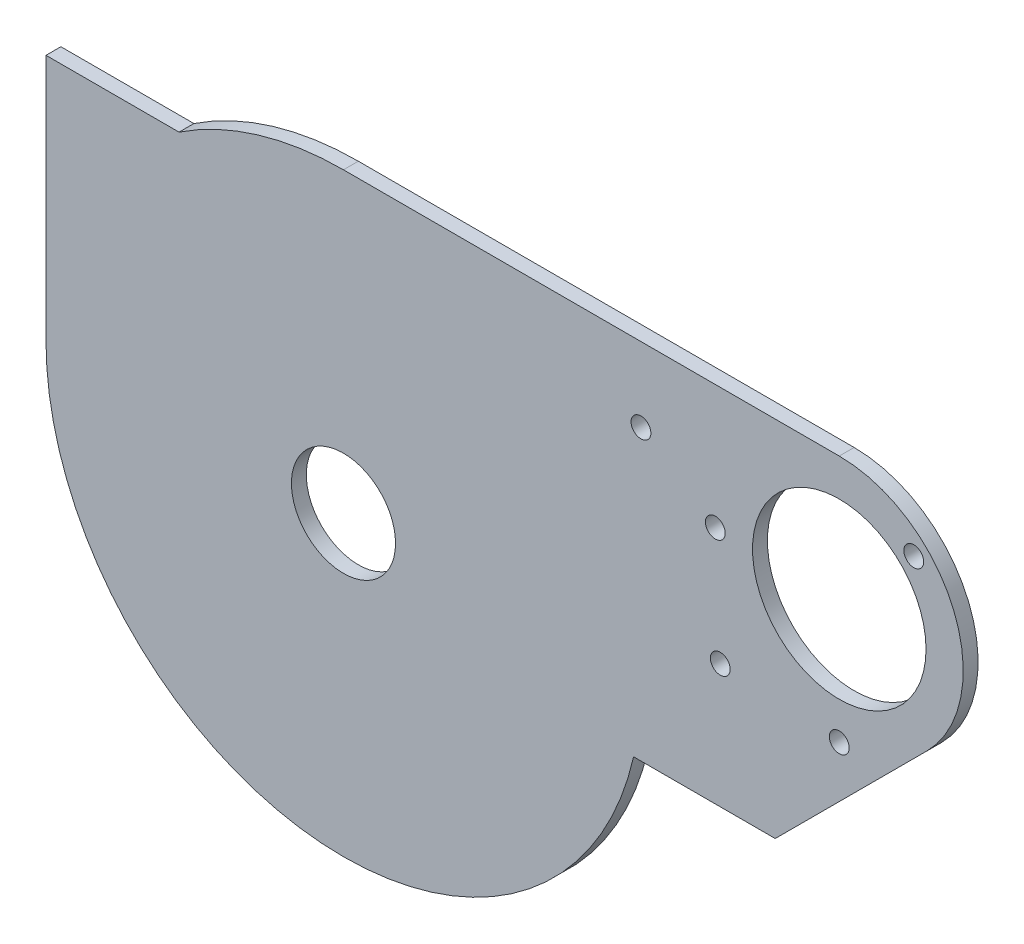
from build123d import *

# Parameters (mm, degrees)
SKETCH1_R           = 10.5
SKETCH1_R_2         = 17.5
BOSS_EXTRUDE1_DEPTH = 3
CUT_EXTRUDE1_REACH  = 140.687
SKETCH2_R           = 2
CUT_EXTRUDE2_REACH  = 140.687
SKETCH3_R           = 2


with BuildPart() as part:
    # Sketch1 → Boss-Extrude1 (new body)
    # profile 1 of 2: a face of its own
    with BuildSketch(Plane.XY):
        with BuildLine():
            ThreePointArc((-60, 0), (-52.867640737, 28.372743309), (-33.166247904, 50))
            Line((-33.166247904, 50), (-60, 50))
            Line((-60, 50), (-60, 0))
        make_face()
    # profile 2 of 2: a face of its own
    with BuildSketch(Plane.XY):
        with BuildLine():
            ThreePointArc((0, 60), (-17.320508076, 57.445626465), (-33.166247904, 50))
            ThreePointArc((-33.166247904, 50), (-52.867640737, 28.372743309), (-60, 0))
            ThreePointArc((-60, 0), (-6.678621673, -59.627141576), (58.513200418, -13.274237334))
            Line((58.513200418, -13.274237334), (87.081101726, -13.274237334))
            Line((87.081101726, -13.274237334), (117.67766953, 17.32233047))
            ThreePointArc((117.67766953, 17.32233047), (123.096988313, 44.567085809), (100, 60))
            Line((100, 60), (0, 60))
        make_face()
        Circle(SKETCH1_R, mode=Mode.SUBTRACT)
        with Locations((100, 35)):
            Circle(SKETCH1_R_2, mode=Mode.SUBTRACT)
    extrude(amount=BOSS_EXTRUDE1_DEPTH)

    # Sketch2 → Cut-Extrude1 (cut, up to next)
    with BuildSketch(Plane.XY.offset(3), mode=Mode.PRIVATE) as cut_extrude1_sk1:
        with Locations((60, 45)):
            Circle(SKETCH2_R)
    cut_extrude1_tool1 = extrude(cut_extrude1_sk1.sketch, amount=-CUT_EXTRUDE1_REACH, mode=Mode.PRIVATE) & part.part
    # Sketch2 → Cut-Extrude1 (cut, up to next)
    with BuildSketch(Plane.XY.offset(3), mode=Mode.PRIVATE) as cut_extrude1_sk2:
        with Locations((76, 11.725762666)):
            Circle(SKETCH2_R)
    cut_extrude1_tool2 = extrude(cut_extrude1_sk2.sketch, amount=-CUT_EXTRUDE1_REACH, mode=Mode.PRIVATE) & part.part
    add(cut_extrude1_tool1.solids().sort_by_distance((60, 45, 3))[0], mode=Mode.SUBTRACT)
    add(cut_extrude1_tool2.solids().sort_by_distance((76, 11.725763, 3))[0], mode=Mode.SUBTRACT)

    # Sketch3 → Cut-Extrude2 (cut, up to next)
    with BuildSketch(Plane.XY.offset(3), mode=Mode.PRIVATE) as cut_extrude2_sk1:
        with Locations((100, 10)):
            Circle(SKETCH3_R)
    cut_extrude2_tool1 = extrude(cut_extrude2_sk1.sketch, amount=-CUT_EXTRUDE2_REACH, mode=Mode.PRIVATE) & part.part
    # Sketch3 → Cut-Extrude2 (cut, up to next)
    with BuildSketch(Plane.XY.offset(3), mode=Mode.PRIVATE) as cut_extrude2_sk2:
        with Locations((75, 35)):
            Circle(SKETCH3_R)
    cut_extrude2_tool2 = extrude(cut_extrude2_sk2.sketch, amount=-CUT_EXTRUDE2_REACH, mode=Mode.PRIVATE) & part.part
    # Sketch3 → Cut-Extrude2 (cut, up to next)
    with BuildSketch(Plane.XY.offset(3), mode=Mode.PRIVATE) as cut_extrude2_sk3:
        with Locations((115.0260191, 50.0260191)):
            Circle(SKETCH3_R)
    cut_extrude2_tool3 = extrude(cut_extrude2_sk3.sketch, amount=-CUT_EXTRUDE2_REACH, mode=Mode.PRIVATE) & part.part
    add(cut_extrude2_tool1.solids().sort_by_distance((100, 10, 3))[0], mode=Mode.SUBTRACT)
    add(cut_extrude2_tool2.solids().sort_by_distance((75, 35, 3))[0], mode=Mode.SUBTRACT)
    add(cut_extrude2_tool3.solids().sort_by_distance((115.026019, 50.026019, 3))[0], mode=Mode.SUBTRACT)


solid = part.part
